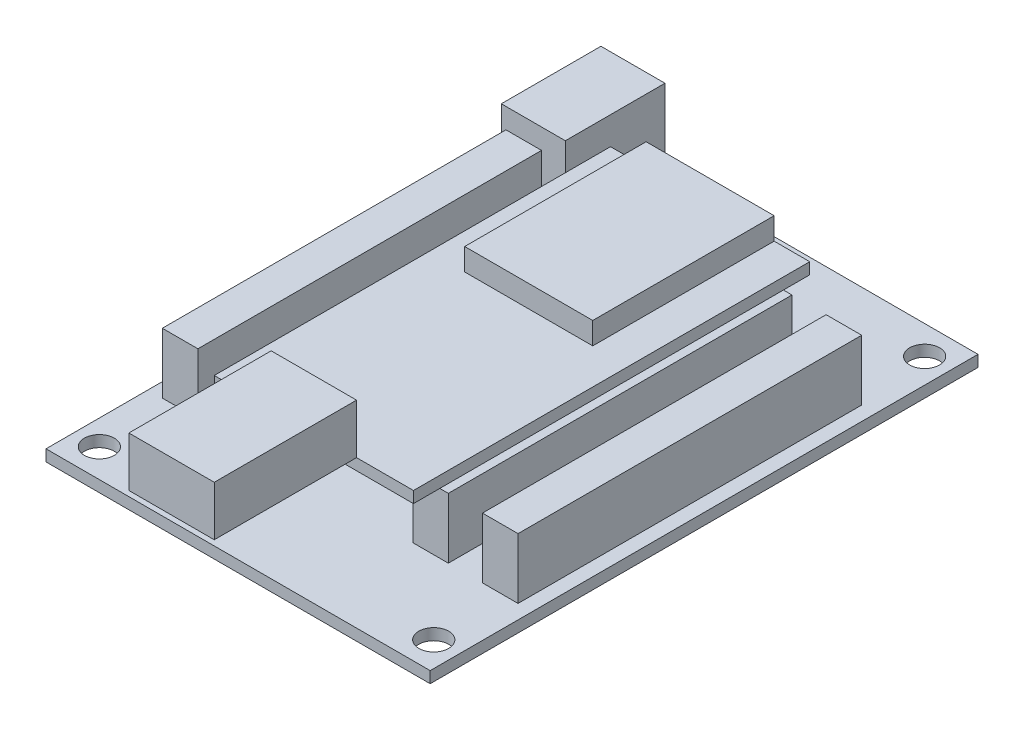
from build123d import *

# Parameters (mm, degrees)
SK_CARRIER_W              = 54
SK_CARRIER_H              = 77
EX_CARRIER_DEPTH          = 1.6
SK_MOUNTHOLES_4XM4_R      = 2.1
CUT_MOUNTHOLES_4XM4_DEPTH = 1.6
SK_FEMALEHEADERS_W        = 5
SK_FEMALEHEADERS_H        = 48.3
EX_FEMALEHEADERS_DEPTH    = 8.5
SK_GPIO_HEADERS_W         = 5
SK_GPIO_HEADERS_H         = 48.3
EX_GPIO_HEADERS_DEPTH     = 8.5
SK_DC_JACK_W              = 9
SK_DC_JACK_H              = 14
EX_DC_JACK_DEPTH          = 11
SK_DEVKIT_W               = 28
SK_DEVKIT_H               = 55.7
EX_DEVKIT_DEPTH           = 1.6
SK_WROOM_MODULE_W         = 18
SK_WROOM_MODULE_H         = 25.5
EX_WROOM_MODULE_DEPTH     = 3.1
SK_KEEPOUT_USB_C_W        = 12
SK_KEEPOUT_USB_C_H        = 20
EX_KEEPOUT_USB_C_DEPTH    = 7


with BuildPart() as part:
    # SK_Carrier → EX_Carrier (new body)
    with BuildSketch(Plane(origin=(0, 0, 0), x_dir=(1, 0, 0), z_dir=(0, 1, 0))):
        Rectangle(SK_CARRIER_W, SK_CARRIER_H)
    extrude(amount=EX_CARRIER_DEPTH)

    # SK_MountHoles_4xM4 → CUT_MountHoles_4xM4 (cut)
    with BuildSketch(Plane(origin=(0, 0, 0), x_dir=(1, 0, 0), z_dir=(0, 1, 0))):
        with Locations((23.5, -34.5)):
            Circle(SK_MOUNTHOLES_4XM4_R)
        with Locations((-23.5, -34.5)):
            Circle(SK_MOUNTHOLES_4XM4_R)
        with Locations((23.5, 34.5)):
            Circle(SK_MOUNTHOLES_4XM4_R)
        with Locations((-23.5, 34.5)):
            Circle(SK_MOUNTHOLES_4XM4_R)
    extrude(amount=CUT_MOUNTHOLES_4XM4_DEPTH, mode=Mode.SUBTRACT)

    # SK_FemaleHeaders → EX_FemaleHeaders (add)
    with BuildSketch(Plane(origin=(0, 1.6, 0), x_dir=(1, 0, 0), z_dir=(0, 1, 0))):
        with Locations((12.7, 0)):
            Rectangle(SK_FEMALEHEADERS_W, SK_FEMALEHEADERS_H)
        with Locations((-12.7, 0)):
            Rectangle(SK_FEMALEHEADERS_W, SK_FEMALEHEADERS_H)
    extrude(amount=EX_FEMALEHEADERS_DEPTH)

    # SK_GPIO_Headers → EX_GPIO_Headers (add)
    with BuildSketch(Plane(origin=(0, 1.6, 0), x_dir=(1, 0, 0), z_dir=(0, 1, 0))):
        with Locations((22.5, 0)):
            Rectangle(SK_GPIO_HEADERS_W, SK_GPIO_HEADERS_H)
        with Locations((-22.5, 0)):
            Rectangle(SK_GPIO_HEADERS_W, SK_GPIO_HEADERS_H)
    extrude(amount=EX_GPIO_HEADERS_DEPTH)

    # SK_DC_Jack → EX_DC_Jack (add)
    with BuildSketch(Plane(origin=(0, 1.6, 0), x_dir=(1, 0, 0), z_dir=(0, 1, 0))):
        with Locations((-21.5, 31.5)):
            Rectangle(SK_DC_JACK_W, SK_DC_JACK_H)
    extrude(amount=EX_DC_JACK_DEPTH)

    # SK_DevKit → EX_DevKit (add)
    with BuildSketch(Plane(origin=(0, 10.1, 0), x_dir=(1, 0, 0), z_dir=(0, 1, 0))):
        Rectangle(SK_DEVKIT_W, SK_DEVKIT_H)
    extrude(amount=EX_DEVKIT_DEPTH)

    # SK_WROOM_Module → EX_WROOM_Module (add)
    with BuildSketch(Plane(origin=(0, 11.7, 0), x_dir=(1, 0, 0), z_dir=(0, 1, 0))):
        with Locations((0, 15.1)):
            Rectangle(SK_WROOM_MODULE_W, SK_WROOM_MODULE_H)
    extrude(amount=EX_WROOM_MODULE_DEPTH)


with BuildPart() as body_2:
    # SK_KeepOut_USB_C → EX_KeepOut_USB_C (new body)
    with BuildSketch(Plane(origin=(0, 11.7, 0), x_dir=(1, 0, 0), z_dir=(0, 1, 0))):
        with Locations((0, -37.85)):
            Rectangle(SK_KEEPOUT_USB_C_W, SK_KEEPOUT_USB_C_H)
    extrude(amount=EX_KEEPOUT_USB_C_DEPTH)


solid = Compound([part.part, body_2.part])
